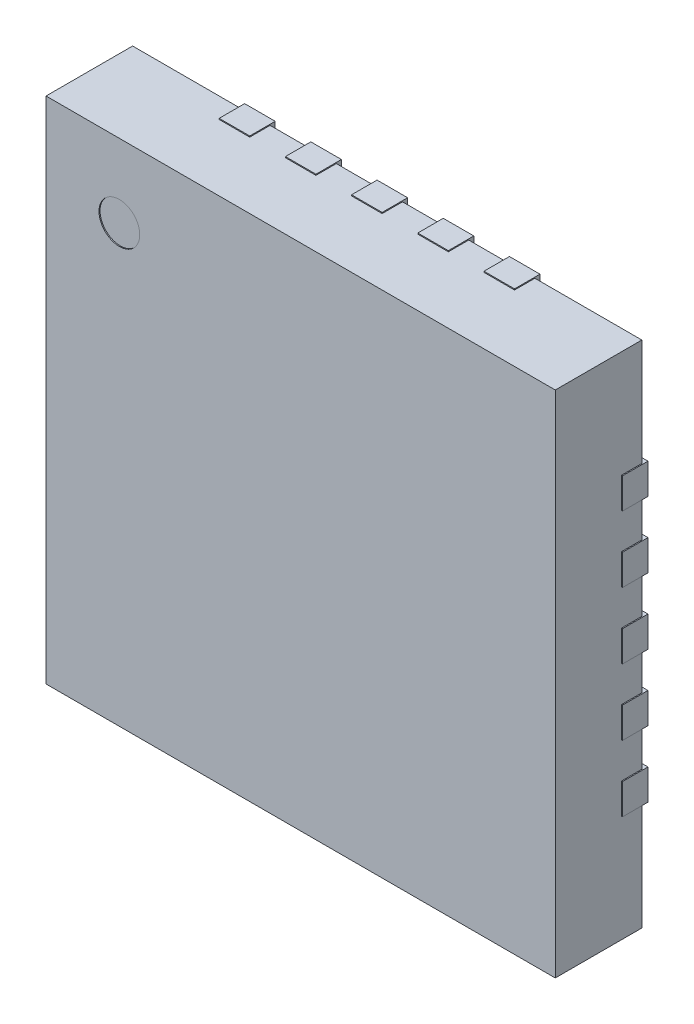
from build123d import *

# Parameters (mm, degrees)
SKETCH1_W            = 5
SKETCH1_H            = 5
BOSS_EXTRUDE1_DEPTH  = 0.85
SKETCH2_R            = 0.2
CUT_EXTRUDE1_DEPTH   = 0.01
BOSS_EXTRUDE2_DEPTH  = 0.05
BOSS_EXTRUDE3_START  = -0.2
BOSS_EXTRUDE3_DEPTH  = 0.25
LPATTERN1_COUNT      = 5
LPATTERN1_PITCH      = 0.65
MIRROR1_START        = -0.2
MIRROR1_COPY_1_DEPTH = 0.25
MIRROR1_COPY_2_DEPTH = 0.25
MIRROR1_COPY_3_DEPTH = 0.25
MIRROR1_COPY_4_DEPTH = 0.25
BOSS_EXTRUDE4_START  = -0.2
BOSS_EXTRUDE4_DEPTH  = 0.25
LPATTERN2_COUNT      = 5
LPATTERN2_PITCH      = 0.65
MIRROR2_START        = -0.2
MIRROR2_COPY_1_DEPTH = 0.25
MIRROR2_COPY_2_DEPTH = 0.25
MIRROR2_COPY_3_DEPTH = 0.25
MIRROR2_COPY_4_DEPTH = 0.25


with BuildPart() as part:
    # Sketch1 → Boss-Extrude1 (new body)
    with BuildSketch(Plane.XY):
        Rectangle(SKETCH1_W, SKETCH1_H)
    extrude(amount=BOSS_EXTRUDE1_DEPTH)

    # Sketch2 → Cut-Extrude1 (cut)
    with BuildSketch(Plane.XY.offset(0.85)):
        with Locations((-1.78, 1.78)):
            Circle(SKETCH2_R)
    extrude(amount=-CUT_EXTRUDE1_DEPTH, mode=Mode.SUBTRACT)

    # Sketch3 → Boss-Extrude2 (add)
    with BuildSketch(Plane(origin=(0, 0, 0), x_dir=(-1, 0, 0), z_dir=(0, 0, -1))):
        with BuildLine():
            Line((1.4625, -1.625), (-1.4625, -1.625))
            ThreePointArc((-1.4625, -1.625), (-1.577404852, -1.577404852), (-1.625, -1.4625))
            Line((-1.625, -1.4625), (-1.625, 1.4625))
            ThreePointArc((-1.625, 1.4625), (-1.577404852, 1.577404852), (-1.4625, 1.625))
            Line((-1.4625, 1.625), (1.4625, 1.625))
            ThreePointArc((1.4625, 1.625), (1.577404852, 1.577404852), (1.625, 1.4625))
            Line((1.625, 1.4625), (1.625, -1.4625))
            ThreePointArc((1.625, -1.4625), (1.577404852, -1.577404852), (1.4625, -1.625))
        make_face()
    extrude(amount=BOSS_EXTRUDE2_DEPTH)

    # Sketch5 → Boss-Extrude3 (add)
    with BuildSketch(Plane(origin=(0, 0, 0), x_dir=(-1, 0, 0), z_dir=(0, 0, -1)).offset(BOSS_EXTRUDE3_START)):
        with BuildLine():
            Line((2.25, 1.45), (2.5, 1.45))
            Line((2.5, 1.45), (2.51, 1.45))
            Line((2.51, 1.45), (2.51, 1.15))
            Line((2.51, 1.15), (2.5, 1.15))
            Line((2.5, 1.15), (2.25, 1.15))
            ThreePointArc((2.25, 1.15), (2.1, 1.3), (2.25, 1.45))
        make_face()
    boss_extrude3 = extrude(amount=BOSS_EXTRUDE3_DEPTH)

    # LPattern1: Boss-Extrude3 ×5
    with Locations(*[(0, -i * LPATTERN1_PITCH, 0) for i in range(1, LPATTERN1_COUNT)]):
        add(boss_extrude3)

    # Mirror1: Boss-Extrude3 across plane
    add(boss_extrude3.mirror(Plane(origin=(0, 0, 0), x_dir=(0, 0, 1), z_dir=(1, 0, 0))))

    # Mirror1 copy 1 sketch → Mirror1 copy 1 (add)
    with BuildSketch(Plane(origin=(0, -0.65, 0), x_dir=(1, 0, 0), z_dir=(0, 0, -1)).offset(MIRROR1_START)):
        with BuildLine():
            Line((2.25, -1.45), (2.5, -1.45))
            Line((2.5, -1.45), (2.51, -1.45))
            Line((2.51, -1.45), (2.51, -1.15))
            Line((2.51, -1.15), (2.5, -1.15))
            Line((2.5, -1.15), (2.25, -1.15))
            ThreePointArc((2.25, -1.15), (2.1, -1.3), (2.25, -1.45))
        make_face()
    extrude(amount=MIRROR1_COPY_1_DEPTH)

    # Mirror1 copy 2 sketch → Mirror1 copy 2 (add)
    with BuildSketch(Plane(origin=(0, -1.3, 0), x_dir=(1, 0, 0), z_dir=(0, 0, -1)).offset(MIRROR1_START)):
        with BuildLine():
            Line((2.25, -1.45), (2.5, -1.45))
            Line((2.5, -1.45), (2.51, -1.45))
            Line((2.51, -1.45), (2.51, -1.15))
            Line((2.51, -1.15), (2.5, -1.15))
            Line((2.5, -1.15), (2.25, -1.15))
            ThreePointArc((2.25, -1.15), (2.1, -1.3), (2.25, -1.45))
        make_face()
    extrude(amount=MIRROR1_COPY_2_DEPTH)

    # Mirror1 copy 3 sketch → Mirror1 copy 3 (add)
    with BuildSketch(Plane(origin=(0, -1.95, 0), x_dir=(1, 0, 0), z_dir=(0, 0, -1)).offset(MIRROR1_START)):
        with BuildLine():
            Line((2.25, -1.45), (2.5, -1.45))
            Line((2.5, -1.45), (2.51, -1.45))
            Line((2.51, -1.45), (2.51, -1.15))
            Line((2.51, -1.15), (2.5, -1.15))
            Line((2.5, -1.15), (2.25, -1.15))
            ThreePointArc((2.25, -1.15), (2.1, -1.3), (2.25, -1.45))
        make_face()
    extrude(amount=MIRROR1_COPY_3_DEPTH)

    # Mirror1 copy 4 sketch → Mirror1 copy 4 (add)
    with BuildSketch(Plane(origin=(0, -2.6, 0), x_dir=(1, 0, 0), z_dir=(0, 0, -1)).offset(MIRROR1_START)):
        with BuildLine():
            Line((2.25, -1.45), (2.5, -1.45))
            Line((2.5, -1.45), (2.51, -1.45))
            Line((2.51, -1.45), (2.51, -1.15))
            Line((2.51, -1.15), (2.5, -1.15))
            Line((2.5, -1.15), (2.25, -1.15))
            ThreePointArc((2.25, -1.15), (2.1, -1.3), (2.25, -1.45))
        make_face()
    extrude(amount=MIRROR1_COPY_4_DEPTH)

    # Sketch6 → Boss-Extrude4 (add)
    with BuildSketch(Plane(origin=(0, 0, 0), x_dir=(-1, 0, 0), z_dir=(0, 0, -1)).offset(BOSS_EXTRUDE4_START)):
        with BuildLine():
            Line((-1.45, 2.51), (-1.15, 2.51))
            Line((-1.15, 2.51), (-1.15, 2.5))
            Line((-1.15, 2.5), (-1.15, 2.25))
            ThreePointArc((-1.15, 2.25), (-1.3, 2.1), (-1.45, 2.25))
            Line((-1.45, 2.25), (-1.45, 2.5))
            Line((-1.45, 2.5), (-1.45, 2.51))
        make_face()
    boss_extrude4 = extrude(amount=BOSS_EXTRUDE4_DEPTH)

    # LPattern2: Boss-Extrude4 ×5
    with Locations(*[(-i * LPATTERN2_PITCH, 0, 0) for i in range(1, LPATTERN2_COUNT)]):
        add(boss_extrude4)

    # Mirror2: Boss-Extrude4 across plane
    add(boss_extrude4.mirror(Plane.ZX))

    # Mirror2 copy 1 sketch → Mirror2 copy 1 (add)
    with BuildSketch(Plane(origin=(-0.65, 0, 0), x_dir=(-1, 0, 0), z_dir=(0, 0, -1)).offset(MIRROR2_START)):
        with BuildLine():
            Line((-1.45, -2.51), (-1.15, -2.51))
            Line((-1.15, -2.51), (-1.15, -2.5))
            Line((-1.15, -2.5), (-1.15, -2.25))
            ThreePointArc((-1.15, -2.25), (-1.3, -2.1), (-1.45, -2.25))
            Line((-1.45, -2.25), (-1.45, -2.5))
            Line((-1.45, -2.5), (-1.45, -2.51))
        make_face()
    extrude(amount=MIRROR2_COPY_1_DEPTH)

    # Mirror2 copy 2 sketch → Mirror2 copy 2 (add)
    with BuildSketch(Plane(origin=(-1.3, 0, 0), x_dir=(-1, 0, 0), z_dir=(0, 0, -1)).offset(MIRROR2_START)):
        with BuildLine():
            Line((-1.45, -2.51), (-1.15, -2.51))
            Line((-1.15, -2.51), (-1.15, -2.5))
            Line((-1.15, -2.5), (-1.15, -2.25))
            ThreePointArc((-1.15, -2.25), (-1.3, -2.1), (-1.45, -2.25))
            Line((-1.45, -2.25), (-1.45, -2.5))
            Line((-1.45, -2.5), (-1.45, -2.51))
        make_face()
    extrude(amount=MIRROR2_COPY_2_DEPTH)

    # Mirror2 copy 3 sketch → Mirror2 copy 3 (add)
    with BuildSketch(Plane(origin=(-1.95, 0, 0), x_dir=(-1, 0, 0), z_dir=(0, 0, -1)).offset(MIRROR2_START)):
        with BuildLine():
            Line((-1.45, -2.51), (-1.15, -2.51))
            Line((-1.15, -2.51), (-1.15, -2.5))
            Line((-1.15, -2.5), (-1.15, -2.25))
            ThreePointArc((-1.15, -2.25), (-1.3, -2.1), (-1.45, -2.25))
            Line((-1.45, -2.25), (-1.45, -2.5))
            Line((-1.45, -2.5), (-1.45, -2.51))
        make_face()
    extrude(amount=MIRROR2_COPY_3_DEPTH)

    # Mirror2 copy 4 sketch → Mirror2 copy 4 (add)
    with BuildSketch(Plane(origin=(-2.6, 0, 0), x_dir=(-1, 0, 0), z_dir=(0, 0, -1)).offset(MIRROR2_START)):
        with BuildLine():
            Line((-1.45, -2.51), (-1.15, -2.51))
            Line((-1.15, -2.51), (-1.15, -2.5))
            Line((-1.15, -2.5), (-1.15, -2.25))
            ThreePointArc((-1.15, -2.25), (-1.3, -2.1), (-1.45, -2.25))
            Line((-1.45, -2.25), (-1.45, -2.5))
            Line((-1.45, -2.5), (-1.45, -2.51))
        make_face()
    extrude(amount=MIRROR2_COPY_4_DEPTH)


solid = part.part
